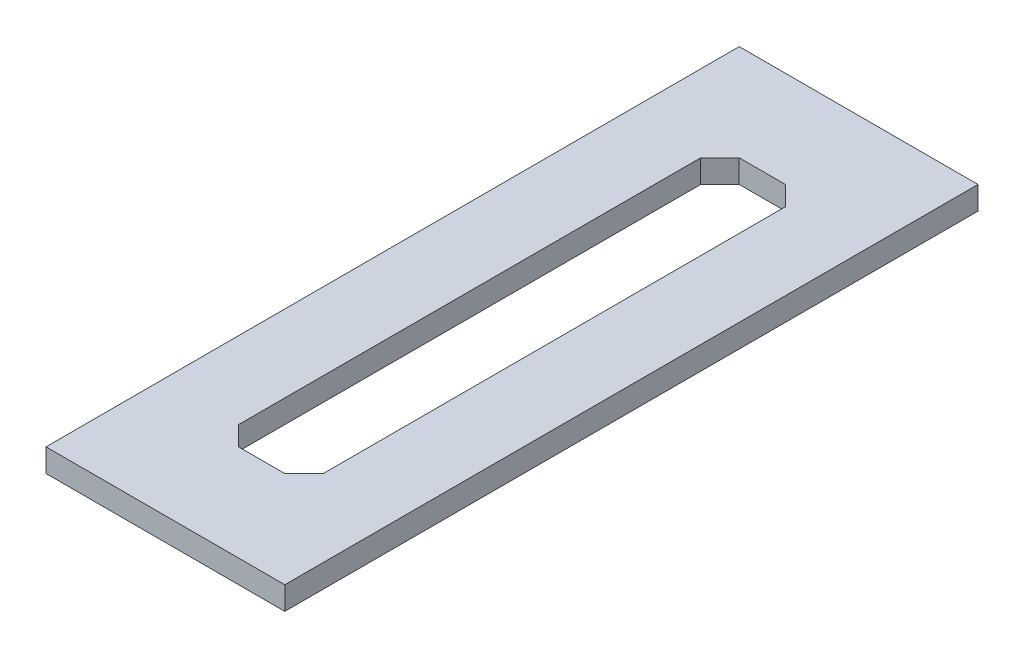
from build123d import *

# Parameters (mm, degrees)
SKETCH1_W           = 62
SKETCH1_H           = 180
BOSS_EXTRUDE1_DEPTH = 6


with BuildPart() as part:
    # Sketch1 → Boss-Extrude1 (new body)
    with BuildSketch(Plane(origin=(0, 0, 0), x_dir=(1, 0, 0), z_dir=(0, 1, 0))):
        with Locations((-54.350383632, 19.795396419)):
            Rectangle(SKETCH1_W, SKETCH1_H)
        Polygon((-48.350383632, 84.795396419), (-43.350383632, 79.795396419), (-43.350383632, -40.204603581), (-48.350383632, -45.204603581), (-60.350383632, -45.204603581), (-65.350383632, -40.204603581), (-65.350383632, 79.795396419), (-60.350383632, 84.795396419), align=None, mode=Mode.SUBTRACT)
    extrude(amount=BOSS_EXTRUDE1_DEPTH)


solid = part.part
